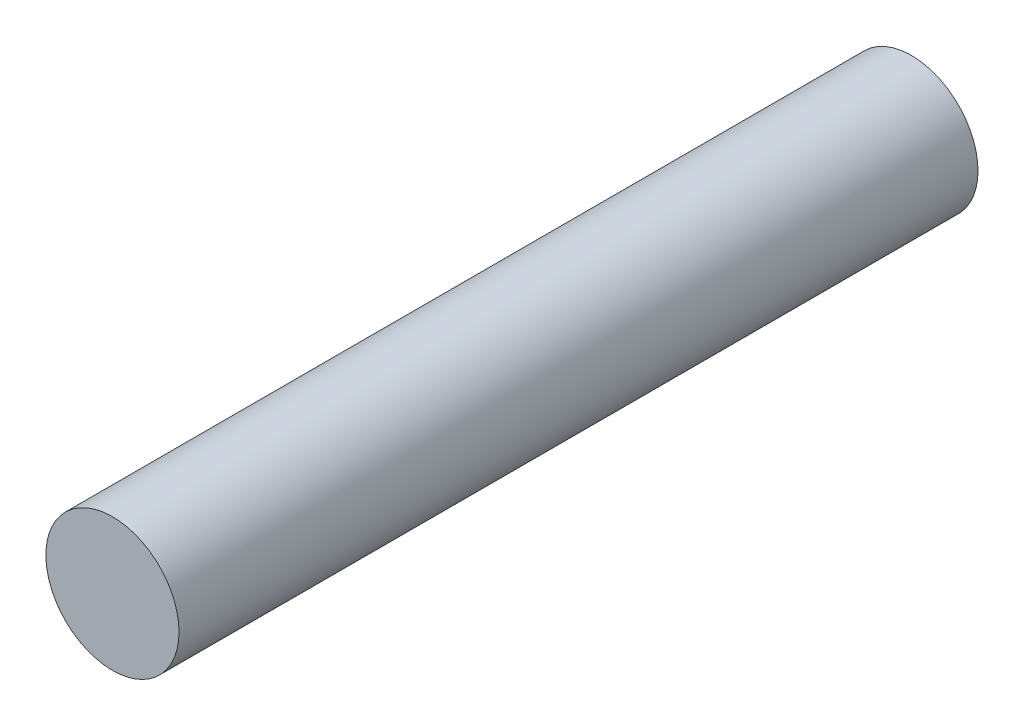
from build123d import *

# Parameters (mm, degrees)
SKETCH_1_R      = 2.5
EXTRUDE_1_DEPTH = 30


with BuildPart() as part:
    # 草图1 → 凸台-拉伸1 (new body)
    with BuildSketch(Plane.XY):
        Circle(SKETCH_1_R)
    extrude(amount=EXTRUDE_1_DEPTH)


solid = part.part
